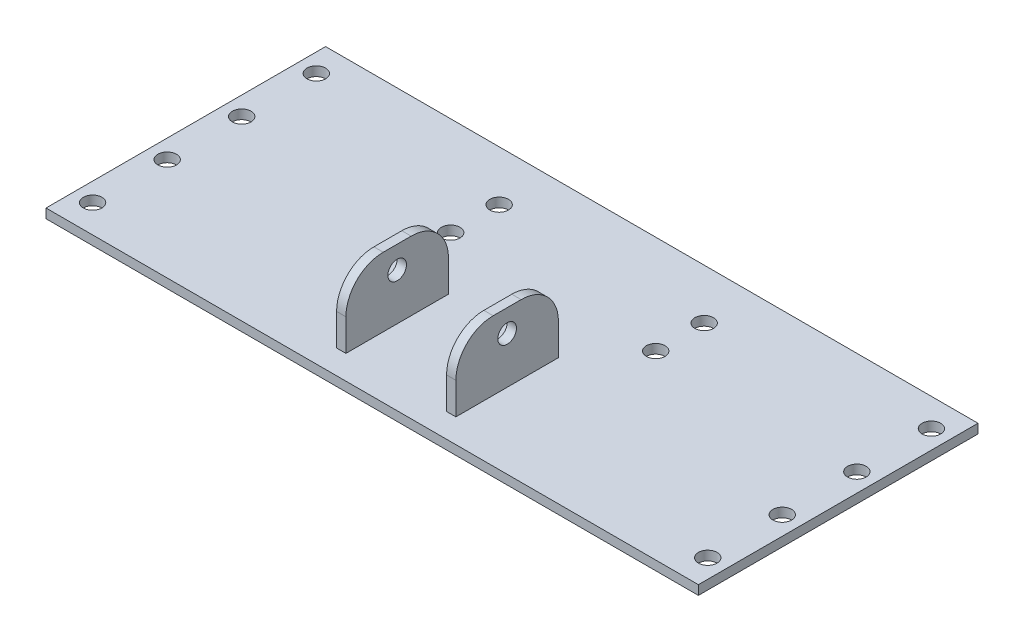
from build123d import *

# Parameters (mm, degrees)
SKETCH1_W            = 350
SKETCH1_H            = 150
BOSS_EXTRUDE1_DEPTH  = 5
SKETCH2_W            = 55
SKETCH2_H            = 42
BOSS_EXTRUDE2_DEPTH  = 5
SKETCH3_R            = 5
CUT_EXTRUDE1_DEPTH   = 225.138350132
FILLET1_R            = 20
FILLET1_OF_MIRROR1_R = 20
SKETCH5_R            = 5
CUT_EXTRUDE3_DEPTH   = 194.956180618
SKETCH6_R            = 5
CUT_EXTRUDE4_DEPTH   = 194.956180618


with BuildPart() as part:
    # Sketch1 → Boss-Extrude1 (new body)
    with BuildSketch(Plane(origin=(0, 0, 0), x_dir=(1, 0, 0), z_dir=(0, 1, 0))):
        Rectangle(SKETCH1_W, SKETCH1_H)
    extrude(amount=BOSS_EXTRUDE1_DEPTH)

    # Sketch2 → Boss-Extrude2 (add)
    with BuildSketch(Plane(origin=(27, 0, 0), x_dir=(0, 0, -1), z_dir=(1, 0, 0))):
        with Locations((-34.6, 21)):
            Rectangle(SKETCH2_W, SKETCH2_H)
    boss_extrude2 = extrude(amount=BOSS_EXTRUDE2_DEPTH)

    # Sketch3 → Cut-Extrude1 (cut, through all)
    with BuildSketch(Plane(origin=(32, 0, 0), x_dir=(0, 0, -1), z_dir=(1, 0, 0))):
        with Locations((-34.6, 30)):
            Circle(SKETCH3_R)
    cut_extrude1 = extrude(amount=-CUT_EXTRUDE1_DEPTH, mode=Mode.SUBTRACT)

    # Fillet1
    fillet1_edges = [part.edges().sort_by_distance(p)[0] for p in [
        (29.5, 42, 62.1),
        (29.5, 42, 7.1),
    ]]
    fillet(fillet1_edges, radius=FILLET1_R)

    # Mirror1: Boss-Extrude2, Cut-Extrude1 across plane
    add(boss_extrude2.mirror(Plane(origin=(0, 0, 0), x_dir=(0, 0, 1), z_dir=(1, 0, 0))))
    add(cut_extrude1.mirror(Plane(origin=(0, 0, 0), x_dir=(0, 0, 1), z_dir=(1, 0, 0))), mode=Mode.SUBTRACT)

    # Fillet1 of Mirror1
    fillet1_of_mirror1_edges = [part.edges().sort_by_distance(p)[0] for p in [
        (-29.5, 42, 62.1),
        (-29.5, 42, 7.1),
    ]]
    fillet(fillet1_of_mirror1_edges, radius=FILLET1_OF_MIRROR1_R)

    # Sketch5 → Cut-Extrude3 (cut, through all)
    with BuildSketch(Plane(origin=(0, 5, 0), x_dir=(1, 0, 0), z_dir=(0, 1, 0))):
        with Locations(Location((-55, 48.1, 0), (0, 0, 270))):
            Circle(SKETCH5_R)
        with Locations(Location((-55, 22.1, 0), (0, 0, 270))):
            Circle(SKETCH5_R)
    cut_extrude3 = extrude(amount=-CUT_EXTRUDE3_DEPTH, mode=Mode.SUBTRACT)

    # Mirror3: Cut-Extrude3 across plane
    add(cut_extrude3.mirror(Plane(origin=(0, 0, 0), x_dir=(0, 0, 1), z_dir=(1, 0, 0))), mode=Mode.SUBTRACT)

    # Sketch6 → Cut-Extrude4 (cut, through all)
    with BuildSketch(Plane(origin=(0, 5, 0), x_dir=(1, 0, 0), z_dir=(0, 1, 0))):
        with Locations(Location((-165, 60, 0), (0, 0, 270))):
            Circle(SKETCH6_R)
        with Locations(Location((-165, 20, 0), (0, 0, 270))):
            Circle(SKETCH6_R)
        with Locations(Location((-165, -20, 0), (0, 0, 270))):
            Circle(SKETCH6_R)
        with Locations(Location((-165, -60, 0), (0, 0, 270))):
            Circle(SKETCH6_R)
    cut_extrude4 = extrude(amount=-CUT_EXTRUDE4_DEPTH, mode=Mode.SUBTRACT)

    # Mirror4: Cut-Extrude4 across plane
    add(cut_extrude4.mirror(Plane(origin=(0, 0, 0), x_dir=(0, 0, 1), z_dir=(1, 0, 0))), mode=Mode.SUBTRACT)


solid = part.part
